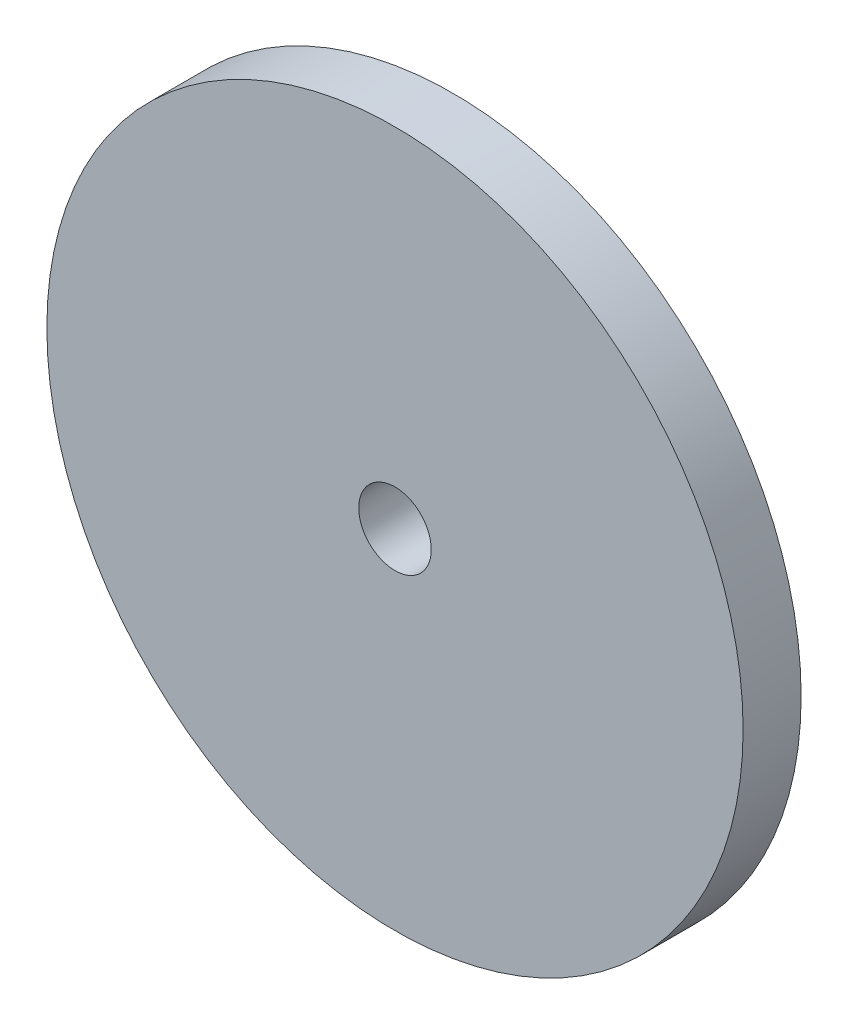
from build123d import *

# Parameters (mm, degrees)
SKETCH2_R           = 30.48
SKETCH2_R_2         = 3.175
BOSS_EXTRUDE1_DEPTH = 5.08


with BuildPart() as part:
    # Sketch2 → Boss-Extrude1 (new body)
    with BuildSketch(Plane.XY):
        Circle(SKETCH2_R)
        Circle(SKETCH2_R_2, mode=Mode.SUBTRACT)
    extrude(amount=BOSS_EXTRUDE1_DEPTH)


solid = part.part
